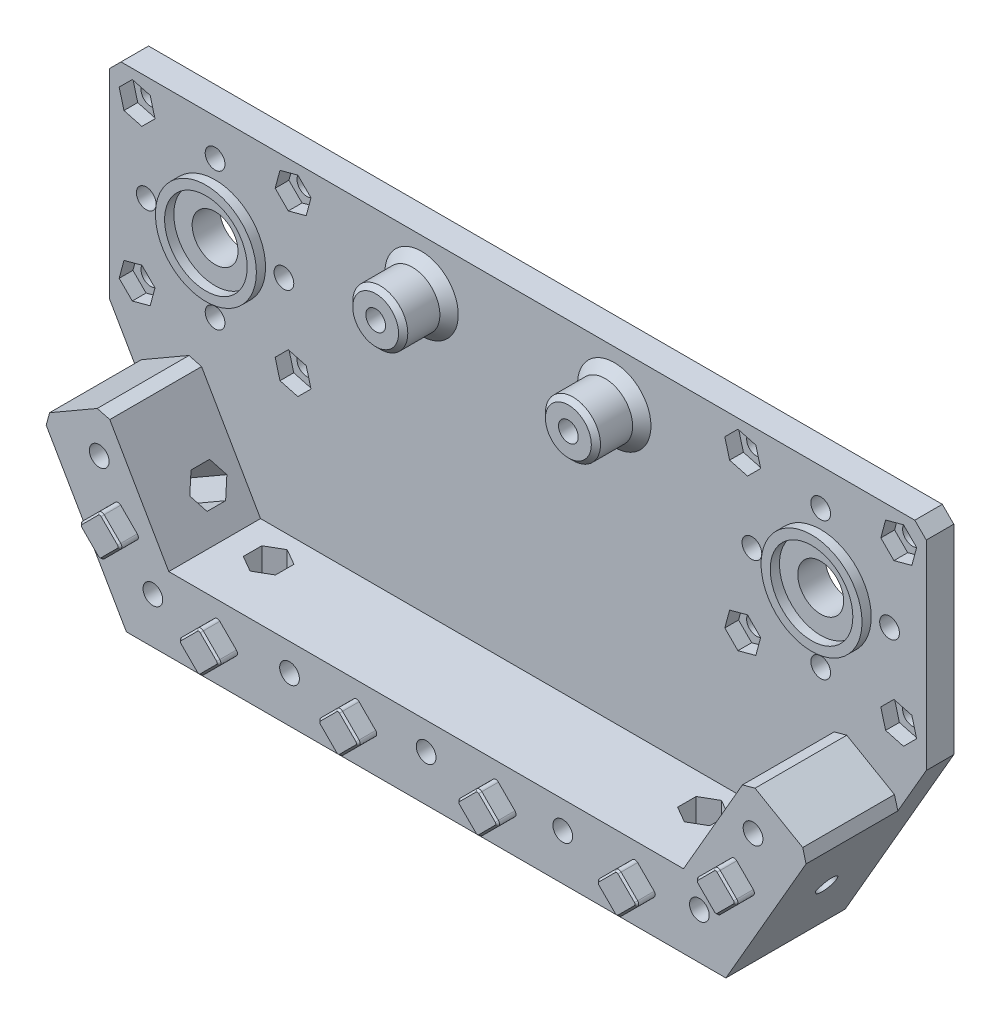
from build123d import *

# Parameters (mm, degrees)
SKETCH1_R           = 4.9999999999999964
SKETCH1_R_2         = 5.000000000000004
BOSS_EXTRUDE1_DEPTH = 6
BOSS_EXTRUDE2_DEPTH = 20
SKETCH4_R           = 2.150000000000001
SKETCH4_R_2         = 2.1500000000000012
CUT_EXTRUDE1_DEPTH  = 112.43159336561604
SKETCH5_R           = 2.150000000000001
SKETCH5_R_2         = 2.1499999999999972
SKETCH5_R_3         = 2.1500000000000044
SKETCH5_R_4         = 2.1499999999999995
CUT_EXTRUDE2_DEPTH  = 113.66321493726336
SKETCH6_R           = 10.999999999999993
SKETCH6_R_2         = 9.000000000000004
SKETCH6_R_3         = 8.999999999999996
BOSS_EXTRUDE4_DEPTH = 2
CUT_EXTRUDE3_START  = -7
SKETCH7_R           = 4.500000000000005
SKETCH7_R_2         = 4.499999999999997
SKETCH7_R_3         = 4.500000000000003
SKETCH7_R_4         = 4.499999999999999
CUT_EXTRUDE3_DEPTH  = 106.66321493726336
BOSS_EXTRUDE5_DEPTH = 4
FILLET1_R           = 0.8
CHAMFER1_SIZE       = 0.4
CUT_EXTRUDE4_DEPTH  = 3
CHAMFER2_SIZE       = 2.5
CUT_EXTRUDE6_DEPTH  = 182.34845465192203
CUT_EXTRUDE7_DEPTH  = 129.0234353546256
CUT_EXTRUDE8_START  = -5
CUT_EXTRUDE8_DEPTH  = 177.34845465192208
CUT_EXTRUDE9_START  = -5
CUT_EXTRUDE9_DEPTH  = 124.0234353546256
CHAMFER3_SIZE       = 2
SKETCH15_R          = 6.000000000000003
SKETCH15_R_2        = 5.999999999999998
BOSS_EXTRUDE6_DEPTH = 10
SKETCH16_R          = 2.1499999999999972
CUT_EXTRUDE10_DEPTH = 111.78357278947091
CUT_EXTRUDE11_DEPTH = 5
CHAMFER4_SIZE       = 2
CHAMFER5_SIZE       = 1


with BuildPart() as part:
    # Sketch1 → Boss-Extrude1 (new body)
    with BuildSketch(Plane.XY):
        Polygon((-65.32863896322534, -64), (65.32863896322536, -64), (88.99999999999999, -22.999999999999975), (88.99999999999999, 23.000000000000025), (42.999999999999986, 23.000000000000018), (-43, 23), (-89, 22.999999999999993), (-89, -23), align=None)
        with Locations((-66, 0)):
            Circle(SKETCH1_R, mode=Mode.SUBTRACT)
        with Locations((66, 1.355e-14)):
            Circle(SKETCH1_R_2, mode=Mode.SUBTRACT)
    extrude(amount=BOSS_EXTRUDE1_DEPTH)

    # Sketch2 → Boss-Extrude2 (add)
    with BuildSketch(Plane.XY.offset(6)):
        Polygon((-83.80384757729335, -32), (-65.32863896322534, -64), (65.32863896322536, -64), (83.80384757729338, -32), (69.94744111674235, -23.999999999999993), (56.09103465619134, -48), (-56.091034656191326, -48), (-69.94744111674234, -24), align=None)
    extrude(amount=BOSS_EXTRUDE2_DEPTH)

    # Sketch4 → Cut-Extrude1 (cut, through all)
    with BuildSketch(Plane.XY.offset(6)):
        with Locations((-49, 17.000000000000004)):
            Circle(SKETCH4_R)
        with Locations((-83, 17)):
            Circle(SKETCH4_R)
        with Locations((-49, -16.999999999999993)):
            Circle(SKETCH4_R)
        with Locations((-83, -17)):
            Circle(SKETCH4_R)
        with Locations((49, 17.000000000000014)):
            Circle(SKETCH4_R)
        with Locations((83, 17.000000000000018)):
            Circle(SKETCH4_R)
        with Locations((83, -16.999999999999986)):
            Circle(SKETCH4_R)
        with Locations((49, -16.99999999999999)):
            Circle(SKETCH4_R)
        with Locations((-81, 0)):
            Circle(SKETCH4_R_2)
        with Locations((-66.00000000000001, 15)):
            Circle(SKETCH4_R)
        with Locations((-51.00000000000001, 5.51e-15)):
            Circle(SKETCH4_R_2)
        with Locations((-66, -15)):
            Circle(SKETCH4_R)
        with Locations((51.00000000000001, 0)):
            Circle(SKETCH4_R_2)
        with Locations((65.99999999999999, 15)):
            Circle(SKETCH4_R)
        with Locations((81, 5.51e-15)):
            Circle(SKETCH4_R_2)
        with Locations((66, -15)):
            Circle(SKETCH4_R)
    extrude(amount=-CUT_EXTRUDE1_DEPTH, mode=Mode.SUBTRACT)

    # Sketch5 → Cut-Extrude2 (cut, through all)
    with BuildSketch(Plane.XY.offset(26.000000000000004)):
        with Locations((-71.24647922241898, -33.74999999999999)):
            Circle(SKETCH5_R)
        with Locations((-59.555136271329076, -53.99999999999999)):
            Circle(SKETCH5_R)
        with Locations((-29.77756813566454, -53.99999999999999)):
            Circle(SKETCH5_R_2)
        with Locations((29.77756813566454, -53.99999999999999)):
            Circle(SKETCH5_R_3)
        with Locations((71.246479222419, -33.749999999999986)):
            Circle(SKETCH5_R)
        with Locations((3.51e-15, -54)):
            Circle(SKETCH5_R_4)
        with Locations((59.55513627132908, -53.99999999999999)):
            Circle(SKETCH5_R)
    extrude(amount=-CUT_EXTRUDE2_DEPTH, mode=Mode.SUBTRACT)

    # Sketch6 → Boss-Extrude4 (add)
    # profile 1 of 2: a face of its own
    with BuildSketch(Plane.XY.offset(6)):
        with Locations((-66, 0)):
            Circle(SKETCH6_R)
        with Locations((-66, 0)):
            Circle(SKETCH6_R_2, mode=Mode.SUBTRACT)
    # profile 2 of 2: a face of its own
    with BuildSketch(Plane.XY.offset(6)):
        with Locations((66, 1.355e-14)):
            Circle(SKETCH6_R)
        with Locations((66, 1.355e-14)):
            Circle(SKETCH6_R_3, mode=Mode.SUBTRACT)
    extrude(amount=BOSS_EXTRUDE4_DEPTH)

    # Sketch7 → Cut-Extrude3 (cut, through all)
    with BuildSketch(Plane.XY.offset(26.000000000000004).offset(CUT_EXTRUDE3_START)):
        with Locations((-71.24647922241898, -33.74999999999999)):
            Circle(SKETCH7_R)
        with Locations((-59.555136271329076, -53.99999999999999)):
            Circle(SKETCH7_R_2)
        with Locations((-29.77756813566454, -53.99999999999999)):
            Circle(SKETCH7_R_3)
        with Locations((3.51e-15, -54)):
            Circle(SKETCH7_R_4)
        with Locations((29.77756813566454, -53.99999999999999)):
            Circle(SKETCH7_R_3)
        with Locations((59.55513627132908, -53.99999999999999)):
            Circle(SKETCH7_R_2)
        with Locations((71.246479222419, -33.749999999999986)):
            Circle(SKETCH7_R)
    extrude(amount=-CUT_EXTRUDE3_DEPTH, mode=Mode.SUBTRACT)

    # Sketch8 → Boss-Extrude5 (add)
    with BuildSketch(Plane.XY.offset(26.000000000000004)):
        Polygon((-62.395243120493035, -44.87500000000001), (-67.13285855444289, -40.137384566050144), (-71.87047398839276, -44.87500000000001), (-67.1328585544429, -49.61261543394988), align=None)
        Polygon((-50.26999304123107, -55.99999999999999), (-45.53237760728124, -51.26238456605012), (-40.79476217333134, -55.99999999999999), (-45.53237760728124, -60.73761543394986), align=None)
        Polygon((-19.915074636376925, -55.99999999999999), (-15.17745920242707, -51.26238456605014), (-10.439843768477186, -55.99999999999999), (-15.17745920242707, -60.73761543394987), align=None)
        Polygon((10.439843768477319, -55.99999999999999), (15.177459202427096, -60.73761543394988), (19.915074636377103, -56), (15.177459202427096, -51.26238456605013), align=None)
        Polygon((50.269993041231146, -55.99999999999999), (45.532377607281255, -51.26238456605019), (40.79476217333143, -55.99999999999999), (45.532377607281276, -60.73761543394991), align=None)
        Polygon((62.395243120493014, -44.875), (67.1328585544429, -49.612615433949856), (71.87047398839272, -44.87500000000001), (67.13285855444289, -40.13738456605014), align=None)
    extrude(amount=BOSS_EXTRUDE5_DEPTH)

    # Fillet1
    fillet1_edges = [part.edges().sort_by_distance(p)[0] for p in [
        (67.13285855444289, -40.13738456605014, 28.000000000000004),
        (71.87047398839272, -44.87500000000001, 28.000000000000004),
        (67.1328585544429, -49.612615433949856, 28.000000000000004),
        (62.395243120493014, -44.875, 28.000000000000004),
        (50.269993041231146, -55.99999999999999, 28.000000000000004),
        (45.532377607281255, -51.26238456605019, 28.000000000000004),
        (40.79476217333143, -55.99999999999999, 28.000000000000004),
        (45.532377607281276, -60.73761543394991, 28.000000000000004),
        (19.915074636377103, -56, 28.000000000000004),
        (15.177459202427096, -51.26238456605013, 28.000000000000004),
        (15.177459202427096, -60.73761543394988, 28.000000000000004),
        (10.439843768477319, -55.99999999999999, 28.000000000000004),
        (-15.17745920242707, -51.26238456605014, 28.000000000000004),
        (-19.915074636376925, -55.99999999999999, 28.000000000000004),
        (-10.439843768477186, -55.99999999999999, 28.000000000000004),
        (-15.17745920242707, -60.73761543394987, 28.000000000000004),
        (-45.53237760728124, -60.73761543394986, 28.000000000000004),
        (-40.79476217333134, -55.99999999999999, 28.000000000000004),
        (-45.53237760728124, -51.26238456605012, 28.000000000000004),
        (-50.26999304123107, -55.99999999999999, 28.000000000000004),
        (-62.395243120493035, -44.87500000000001, 28.000000000000004),
        (-67.1328585544429, -49.61261543394988, 28.000000000000004),
        (-67.13285855444289, -40.137384566050144, 28.000000000000004),
        (-71.87047398839276, -44.87500000000001, 28.000000000000004),
    ]]
    fillet(fillet1_edges, radius=FILLET1_R)

    # Chamfer1
    chamfer1_edges = [part.edges().sort_by_distance(p)[0] for p in [
        (-67.1328585544429, -49.2812445840514, 30.000000000000004),
        (-69.50166627141783, -47.24380771697494, 30.000000000000004),
        (-71.53910313849428, -44.87499999999999, 30.000000000000004),
        (-69.50166627141782, -42.50619228302507, 30.000000000000004),
        (-67.13285855444289, -40.46875541594862, 30.000000000000004),
        (-64.76405083746796, -42.50619228302507, 30.000000000000004),
        (-62.72661397039151, -44.87500000000001, 30.000000000000004),
        (-64.76405083746798, -47.24380771697494, 30.000000000000004),
        (-49.9386221913326, -56, 30.000000000000004),
        (-47.90118532425616, -53.631192283025065, 30.000000000000004),
        (-45.53237760728123, -51.59375541594861, 30.000000000000004),
        (-43.163569890306285, -53.631192283025065, 30.000000000000004),
        (-41.126133023229826, -55.99999999999999, 30.000000000000004),
        (-43.16356989030629, -58.36880771697493, 30.000000000000004),
        (-45.53237760728124, -60.40624458405139, 30.000000000000004),
        (-47.901185324256154, -58.36880771697493, 30.000000000000004),
        (-10.771214618375662, -55.99999999999999, 30.000000000000004),
        (-12.808651485452126, -58.36880771697493, 30.000000000000004),
        (-15.177459202427066, -60.40624458405139, 30.000000000000004),
        (-17.546266919401994, -58.368807716974935, 30.000000000000004),
        (-19.58370378647845, -55.99999999999999, 30.000000000000004),
        (-17.546266919401997, -53.631192283025065, 30.000000000000004),
        (-15.177459202427064, -51.59375541594862, 30.000000000000004),
        (-12.808651485452126, -53.631192283025065, 30.000000000000004),
        (15.177459202427103, -60.40624458405141, 30.000000000000004),
        (12.808651485452204, -58.36880771697493, 30.000000000000004),
        (10.771214618375781, -55.99999999999999, 30.000000000000004),
        (12.808651485452202, -53.631192283025065, 30.000000000000004),
        (15.177459202427098, -51.59375541594861, 30.000000000000004),
        (17.54626691940209, -53.63119228302506, 30.000000000000004),
        (19.58370378647861, -56, 30.000000000000004),
        (17.54626691940209, -58.36880771697495, 30.000000000000004),
        (45.532377607281276, -60.40624458405143, 30.000000000000004),
        (43.16356989030635, -58.36880771697495, 30.000000000000004),
        (41.126133023229904, -56, 30.000000000000004),
        (43.16356989030635, -53.63119228302509, 30.000000000000004),
        (45.53237760728126, -51.59375541594866, 30.000000000000004),
        (47.9011853242562, -53.63119228302509, 30.000000000000004),
        (49.93862219133266, -55.99999999999999, 30.000000000000004),
        (47.90118532425621, -58.36880771697495, 30.000000000000004),
        (71.53910313849424, -44.87500000000001, 30.000000000000004),
        (69.5016662714178, -47.243807716974935, 30.000000000000004),
        (67.1328585544429, -49.28124458405138, 30.000000000000004),
        (64.76405083746796, -47.24380771697493, 30.000000000000004),
        (62.7266139703915, -44.875, 30.000000000000004),
        (64.76405083746795, -42.506192283025065, 30.000000000000004),
        (67.13285855444289, -40.46875541594862, 30.000000000000004),
        (69.5016662714178, -42.50619228302508, 30.000000000000004),
    ]]
    chamfer(chamfer1_edges, length=CHAMFER1_SIZE)

    # Sketch9 → Cut-Extrude4 (cut)
    with BuildSketch(Plane.XY.offset(6)):
        Polygon((-84.04600471752941, 20.903742750776455), (-86.90374275077644, 18.046004717529403), (-85.85773803324705, 14.14226196675296), (-81.95399528247061, 13.096257249223575), (-79.09625724922357, 15.953995282470618), (-80.14226196675297, 19.857738033247053), align=None)
        Polygon((-51.85773803324704, 19.85773803324705), (-52.90374275077644, 15.953995282470611), (-50.04600471752939, 13.09625724922357), (-46.142261966752955, 14.142261966752963), (-45.09625724922357, 18.046004717529403), (-47.9539952824706, 20.90374275077644), align=None)
        Polygon((-85.85773803324706, -14.142261966752967), (-86.90374275077646, -18.04600471752941), (-84.04600471752941, -20.903742750776452), (-80.14226196675297, -19.857738033247056), (-79.09625724922357, -15.953995282470615), (-81.95399528247061, -13.096257249223575), align=None)
        Polygon((-52.90374275077644, -15.953995282470597), (-51.85773803324704, -19.857738033247045), (-47.95399528247061, -20.90374275077644), (-45.09625724922356, -18.046004717529392), (-46.142261966752955, -14.142261966752958), (-50.04600471752939, -13.09625724922356), align=None)
        Polygon((52.90374275077643, 15.953995282470625), (51.85773803324702, 19.857738033247053), (47.95399528247059, 20.903742750776466), (45.096257249223555, 18.046004717529417), (46.14226196675295, 14.142261966752983), (50.046004717529385, 13.096257249223585), align=None)
        Polygon((80.14226196675295, 19.857738033247053), (79.09625724922357, 15.953995282470618), (81.95399528247061, 13.096257249223584), (85.85773803324705, 14.142261966752978), (86.90374275077643, 18.046004717529424), (84.04600471752939, 20.903742750776455), align=None)
        Polygon((81.95399528247059, -13.096257249223553), (79.09625724922356, -15.953995282470604), (80.14226196675297, -19.85773803324705), (84.04600471752941, -20.903742750776395), (86.90374275077644, -18.04600471752935), (85.857738033247, -14.142261966752924), align=None)
        Polygon((46.14226196675295, -14.142261966752958), (45.09625724922356, -18.0460047175294), (47.95399528247061, -20.90374275077643), (51.857738033247024, -19.857738033247017), (52.90374275077644, -15.953995282470594), (50.0460047175294, -13.096257249223557), align=None)
    extrude(amount=-CUT_EXTRUDE4_DEPTH, mode=Mode.SUBTRACT)

    # Chamfer2
    chamfer2_edges = [part.edges().sort_by_distance(p)[0] for p in [
        (88.99999999999999, 23.000000000000025, 3),
        (-89, 22.999999999999993, 3),
    ]]
    chamfer(chamfer2_edges, length=CHAMFER2_SIZE)

    # Sketch11 → Cut-Extrude6 (cut, through all)
    with BuildSketch(Plane(origin=(-76.70929214352103, -44.28813046840751, 0), x_dir=(0, 0, 1), z_dir=(-0.8660254037844387, -0.5000000000000001, 0))):
        with BuildLine():
            Line((14.861954618136547, -3.686306360591406), (15.482606157515399, -4.761306360591408))
            Line((15.482606157515399, -4.761306360591408), (14.861954618136544, -5.8363063605914105))
            ThreePointArc((14.861954618136544, -5.8363063605914105), (10.850000000000005, -4.761306360591406), (14.861954618136547, -3.686306360591406))
        make_face()
    cut_extrude6 = extrude(amount=-CUT_EXTRUDE6_DEPTH, mode=Mode.SUBTRACT)

    # Sketch12 → Cut-Extrude7 (cut, through all)
    with BuildSketch(Plane.XZ.offset(64)):
        with BuildLine():
            Line((-48.403638963225355, 14.86195461813654), (-47.32863896322533, 15.482606157515395))
            Line((-47.32863896322533, 15.482606157515395), (-46.25363896322535, 14.861954618136547))
            ThreePointArc((-46.25363896322535, 14.861954618136547), (-47.32863896322532, 10.849999999999998), (-48.403638963225355, 14.86195461813654))
        make_face()
    cut_extrude7 = extrude(amount=-CUT_EXTRUDE7_DEPTH, mode=Mode.SUBTRACT)

    # Sketch13 → Cut-Extrude8 (cut, through all)
    with BuildSketch(Plane(origin=(-76.70929214352107, -44.28813046840753, 0), x_dir=(0, 0, 1), z_dir=(-0.8660254037844386, -0.5, 0)).offset(CUT_EXTRUDE8_START)):
        Polygon((17.041451884327376, -4.761306360591408), (15.02072594216369, -1.2613063605914108), (10.979274057836314, -1.2613063605914108), (8.958548115672624, -4.761306360591411), (10.979274057836315, -8.26130636059141), (15.020725942163688, -8.26130636059141), align=None)
    cut_extrude8 = extrude(amount=-CUT_EXTRUDE8_DEPTH, mode=Mode.SUBTRACT)

    # Sketch14 → Cut-Extrude9 (cut, through all)
    with BuildSketch(Plane.XZ.offset(64).offset(CUT_EXTRUDE9_START)):
        Polygon((-47.328638963225345, 17.04145188432739), (-50.828638963225345, 15.0207259421637), (-50.828638963225345, 10.97927405783631), (-47.32863896322534, 8.958548115672617), (-43.82863896322534, 10.979274057836308), (-43.82863896322534, 15.020725942163695), align=None)
    cut_extrude9 = extrude(amount=-CUT_EXTRUDE9_DEPTH, mode=Mode.SUBTRACT)

    # Mirror1: Cut-Extrude6, Cut-Extrude7, Cut-Extrude8, Cut-Extrude9 across plane
    add(cut_extrude6.mirror(Plane(origin=(0, 0, 0), x_dir=(0, 0, 1), z_dir=(1, 0, 0))), mode=Mode.SUBTRACT)
    add(cut_extrude7.mirror(Plane(origin=(0, 0, 0), x_dir=(0, 0, 1), z_dir=(1, 0, 0))), mode=Mode.SUBTRACT)
    add(cut_extrude8.mirror(Plane(origin=(0, 0, 0), x_dir=(0, 0, 1), z_dir=(1, 0, 0))), mode=Mode.SUBTRACT)
    add(cut_extrude9.mirror(Plane(origin=(0, 0, 0), x_dir=(0, 0, 1), z_dir=(1, 0, 0))), mode=Mode.SUBTRACT)

    # Chamfer3
    chamfer3_edges = [part.edges().sort_by_distance(p)[0] for p in [
        (-83.80384757729335, -32, 16),
        (83.80384757729338, -32, 16),
        (69.94744111674235, -23.999999999999993, 16),
        (-69.94744111674234, -24, 16),
    ]]
    chamfer(chamfer3_edges, length=CHAMFER3_SIZE)

    # Sketch15 → Boss-Extrude6 (add)
    with BuildSketch(Plane.XY.offset(6)):
        with Locations((-21, 12)):
            Circle(SKETCH15_R)
        with Locations((21, 12.000000000000007)):
            Circle(SKETCH15_R_2)
    extrude(amount=BOSS_EXTRUDE6_DEPTH)

    # Sketch16 → Cut-Extrude10 (cut, through all)
    with BuildSketch(Plane.XY.offset(16)):
        with Locations((-21, 12)):
            Circle(SKETCH16_R)
        with Locations((21, 12.000000000000007)):
            Circle(SKETCH16_R)
    extrude(amount=-CUT_EXTRUDE10_DEPTH, mode=Mode.SUBTRACT)

    # Sketch17 → Cut-Extrude11 (cut)
    with BuildSketch(Plane(origin=(0, 0, 0), x_dir=(-1, 0, 0), z_dir=(0, 0, -1))):
        Polygon((-16.95854811567262, 12.000000000000004), (-18.97927405783631, 15.500000000000004), (-23.02072594216369, 15.500000000000002), (-25.04145188432738, 12.000000000000004), (-23.02072594216369, 8.500000000000005), (-18.97927405783631, 8.500000000000007), align=None)
        Polygon((16.95854811567262, 12), (18.979274057836314, 8.49999999999999), (23.020725942163693, 8.49999999999999), (25.041451884327383, 11.999999999999998), (23.020725942163697, 15.500000000000005), (18.979274057836314, 15.500000000000005), align=None)
    extrude(amount=-CUT_EXTRUDE11_DEPTH, mode=Mode.SUBTRACT)

    # Chamfer4
    chamfer4_edges = [part.edges().sort_by_distance(p)[0] for p in [
        (15.000000000000002, 12.00000000000001, 6),
        (-27.000000000000004, 12, 6),
    ]]
    chamfer(chamfer4_edges, length=CHAMFER4_SIZE)

    # Chamfer5
    chamfer5_edges = [part.edges().sort_by_distance(p)[0] for p in [
        (15.000000000000002, 12.00000000000001, 16),
        (-27.000000000000004, 12, 16),
    ]]
    chamfer(chamfer5_edges, length=CHAMFER5_SIZE)


solid = part.part
